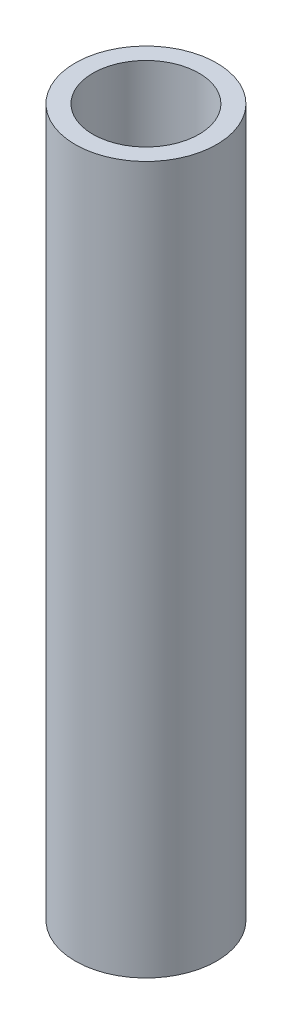
from build123d import *

# Parameters (mm, degrees)
SKETCH1_R           = 2
BOSS_EXTRUDE1_DEPTH = 20
SKETCH3_R           = 1.5
CUT_EXTRUDE1_DEPTH  = 3


with BuildPart() as part:
    # Sketch1 → Boss-Extrude1 (new body)
    with BuildSketch(Plane(origin=(0, 0, 0), x_dir=(1, 0, 0), z_dir=(0, 1, 0))):
        with Locations(Location((0, 0, 0), (0, 0, 270))):
            Circle(SKETCH1_R)
    extrude(amount=BOSS_EXTRUDE1_DEPTH)

    # Sketch3 → Cut-Extrude1 (cut)
    with BuildSketch(Plane(origin=(0, 20, 0), x_dir=(1, 0, 0), z_dir=(0, 1, 0))):
        with Locations(Location((0, 0, 0), (0, 0, 270))):
            Circle(SKETCH3_R)
    extrude(amount=-CUT_EXTRUDE1_DEPTH, mode=Mode.SUBTRACT)


solid = part.part
